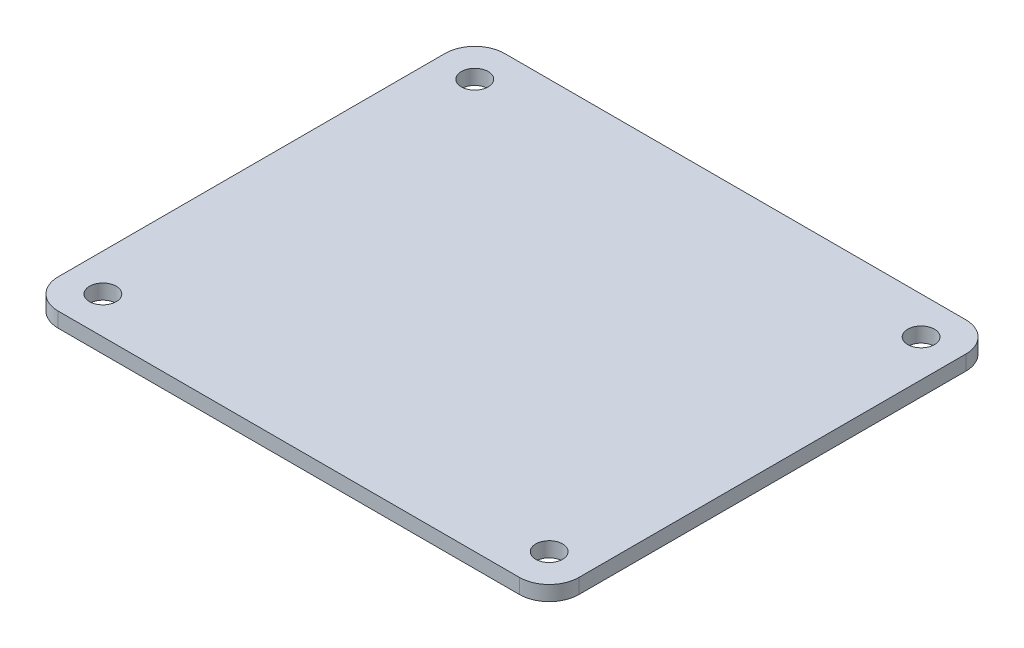
from build123d import *

# Parameters (mm, degrees)
SKETCH1_W           = 35
SKETCH1_H           = 30
BOSS_EXTRUDE1_DEPTH = 1
FILLET1_R           = 2
SKETCH2_R           = 0.9
CUT_EXTRUDE1_DEPTH  = 1


with BuildPart() as part:
    # Sketch1 → Boss-Extrude1 (new body)
    with BuildSketch(Plane(origin=(0, 0, 0), x_dir=(1, 0, 0), z_dir=(0, 1, 0))):
        with Locations((43.582085572, -4.45318849)):
            Rectangle(SKETCH1_W, SKETCH1_H)
    extrude(amount=BOSS_EXTRUDE1_DEPTH)

    # Fillet1
    fillet1_edges = [part.edges().sort_by_distance(p)[0] for p in [
        (61.082085572, 0.5, 19.45318849),
        (26.082085572, 0.5, 19.45318849),
        (26.082085572, 0.5, -10.54681151),
        (61.082085572, 0.5, -10.54681151),
    ]]
    fillet(fillet1_edges, radius=FILLET1_R)

    # Sketch2 → Cut-Extrude1 (cut)
    with BuildSketch(Plane(origin=(0, 1, 0), x_dir=(1, 0, 0), z_dir=(0, 1, 0))):
        with Locations(Location((58.582085572, -16.95318849, 0), (0, 0, 270))):
            Circle(SKETCH2_R)
        with Locations(Location((28.582085572, -16.95318849, 0), (0, 0, 270))):
            Circle(SKETCH2_R)
        with Locations(Location((28.582085572, 8.04681151, 0), (0, 0, 270))):
            Circle(SKETCH2_R)
        with Locations(Location((58.582085572, 8.04681151, 0), (0, 0, 270))):
            Circle(SKETCH2_R)
    extrude(amount=-CUT_EXTRUDE1_DEPTH, mode=Mode.SUBTRACT)


solid = part.part
